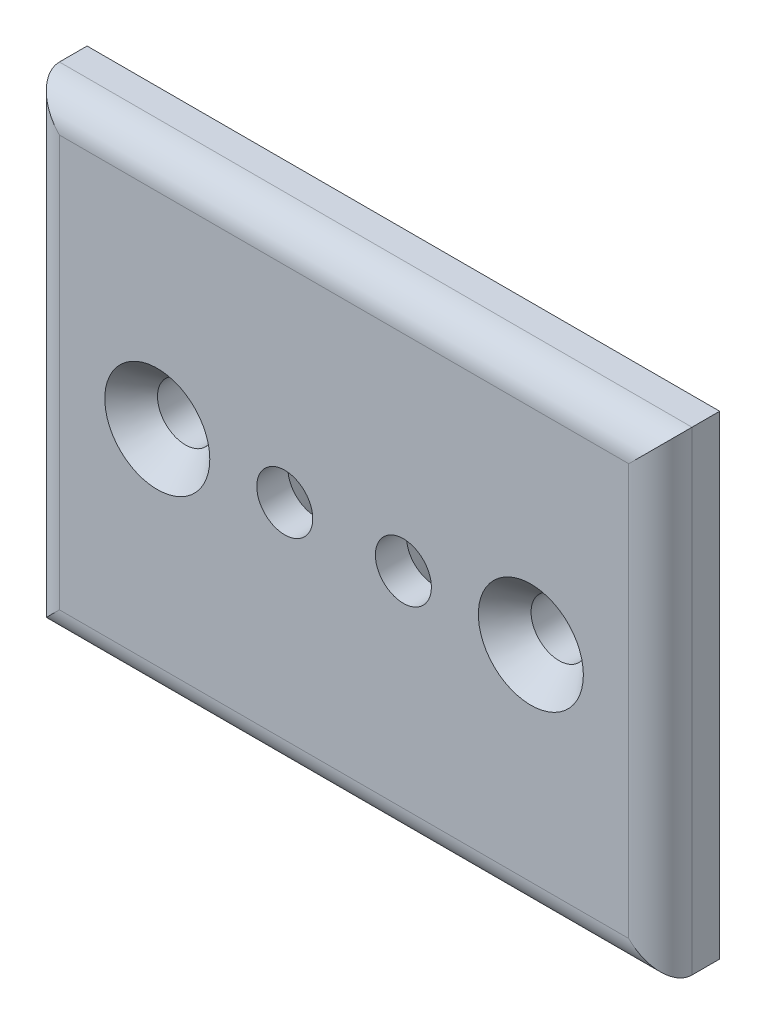
from build123d import *

# Parameters (mm, degrees)
SKETCH1_W                                     = 50.8
SKETCH1_H                                     = 38.1
BODY_DEPTH                                    = 4.7625
CSK_FOR_8_FLAT_HEAD_MACHINE_SCREW1_AT_2_COUNT = 2
CSK_FOR_8_FLAT_HEAD_MACHINE_SCREW1_AT_2_PITCH = 30
CSK_FOR_8_FLAT_HEAD_MACHINE_SCREW2_AT_2_COUNT = 2
CSK_FOR_8_FLAT_HEAD_MACHINE_SCREW2_AT_2_PITCH = 9.525
FILLET1_R                                     = 2.54


with BuildPart() as part:
    # Sketch1 → Body (new body)
    with BuildSketch(Plane.XY):
        Rectangle(SKETCH1_W, SKETCH1_H)
    extrude(amount=BODY_DEPTH)

    # Sketch2 → CSK for #8 Flat Head Machine Screw1 (revolve, cut)
    with BuildSketch(Plane(origin=(-15, 0, 4.7625), x_dir=(0, -1, 0), z_dir=(1, 0, 0))):
        Polygon((0, 0), (0, 4.7625), (2.2479, 4.7625), (2.2479, 2.26450021), (4.2164, 0), align=None)
    csk_for_8_flat_head_machine_screw1 = revolve(axis=Axis((-15, 0, 11.1125), (0, 0, -1)), mode=Mode.SUBTRACT)

    # CSK for #8 Flat Head Machine Screw1 at 2: CSK for #8 Flat Head Machine Screw1 ×2
    with Locations(*[(i * CSK_FOR_8_FLAT_HEAD_MACHINE_SCREW1_AT_2_PITCH, 0, 0) for i in range(1, CSK_FOR_8_FLAT_HEAD_MACHINE_SCREW1_AT_2_COUNT)]):
        add(csk_for_8_flat_head_machine_screw1, mode=Mode.SUBTRACT)

    # Sketch3 → CSK for #8 Flat Head Machine Screw2 (revolve, cut)
    with BuildSketch(Plane.YZ.offset(4.7625)):
        Polygon((0, 0), (0, 4.7625), (2.2479, 4.7625), (2.2479, 2.26450021), (4.2164, 0), align=None)
    csk_for_8_flat_head_machine_screw2 = revolve(axis=Axis((4.7625, 0, -6.35), (0, 0, 1)), mode=Mode.SUBTRACT)

    # CSK for #8 Flat Head Machine Screw2 at 2: CSK for #8 Flat Head Machine Screw2 ×2
    with Locations(*[(-i * CSK_FOR_8_FLAT_HEAD_MACHINE_SCREW2_AT_2_PITCH, 0, 0) for i in range(1, CSK_FOR_8_FLAT_HEAD_MACHINE_SCREW2_AT_2_COUNT)]):
        add(csk_for_8_flat_head_machine_screw2, mode=Mode.SUBTRACT)

    # Fillet1
    fillet1_edges = [part.edges().sort_by_distance(p)[0] for p in [
        (-25.4, 0, 4.7625),
        (0, -19.05, 4.7625),
        (25.4, 0, 4.7625),
        (0, 19.05, 4.7625),
    ]]
    fillet(fillet1_edges, radius=FILLET1_R)


solid = part.part
